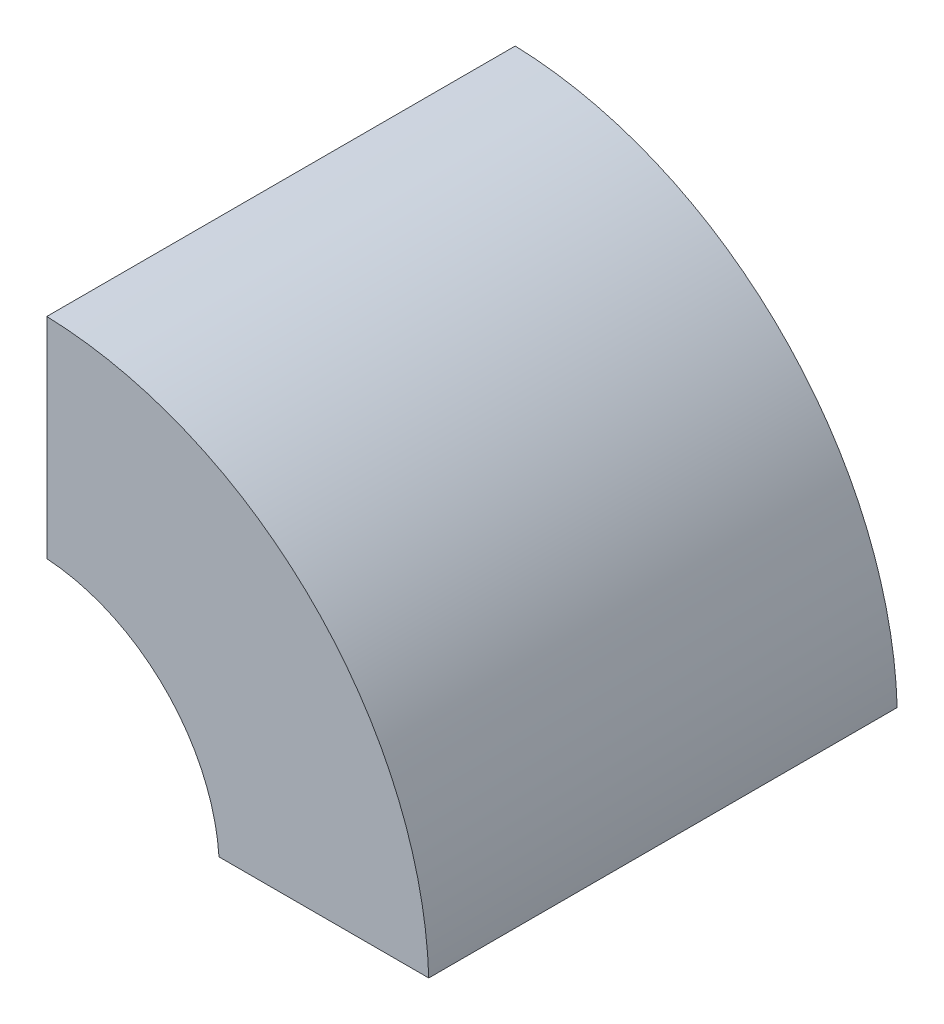
from build123d import *

# Parameters (mm, degrees)
BOSS_EXTRUDE1_DEPTH = 19


with BuildPart() as part:
    # Sketch1 → Boss-Extrude1 (new body)
    with BuildSketch(Plane.XY):
        with BuildLine():
            Line((0.5, 15.992185592), (0.5, 7.483314774))
            ThreePointArc((0.5, 7.483314774), (5.303300859, 5.303300859), (7.483314774, 0.5))
            Line((7.483314774, 0.5), (15.992185592, 0.5))
            ThreePointArc((15.992185592, 0.5), (11.313708499, 11.313708499), (0.5, 15.992185592))
        make_face()
    extrude(amount=-BOSS_EXTRUDE1_DEPTH)


solid = part.part
